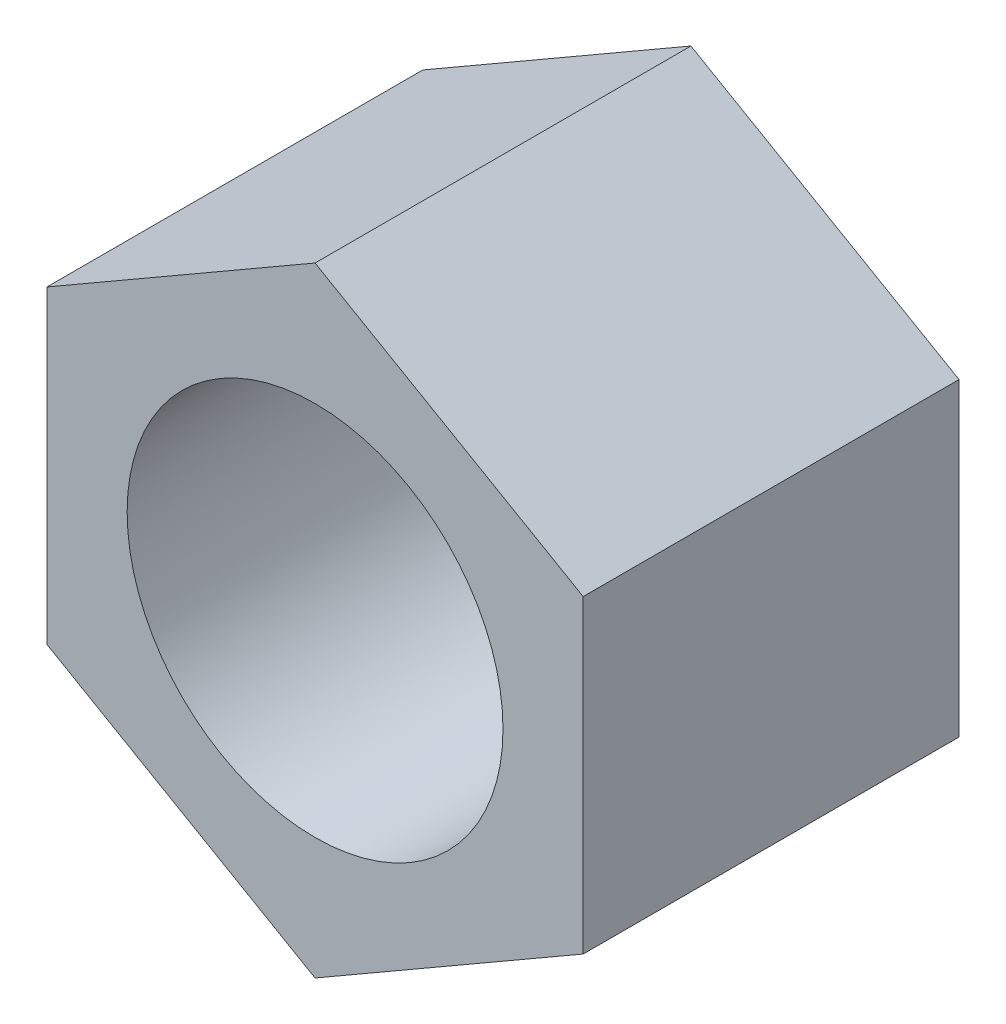
from build123d import *

# Parameters (mm, degrees)
SKETCH_1_R      = 3
EXTRUDE_1_DEPTH = 6


with BuildPart() as part:
    # 草图1 → 凸台-拉伸1 (new body)
    with BuildSketch(Plane.XY):
        Polygon((0, -4.942146607), (4.280024511, -2.471073303), (4.280024511, 2.471073303), (0, 4.942146607), (-4.280024511, 2.471073303), (-4.280024511, -2.471073303), align=None)
        Circle(SKETCH_1_R, mode=Mode.SUBTRACT)
    extrude(amount=EXTRUDE_1_DEPTH)


solid = part.part
